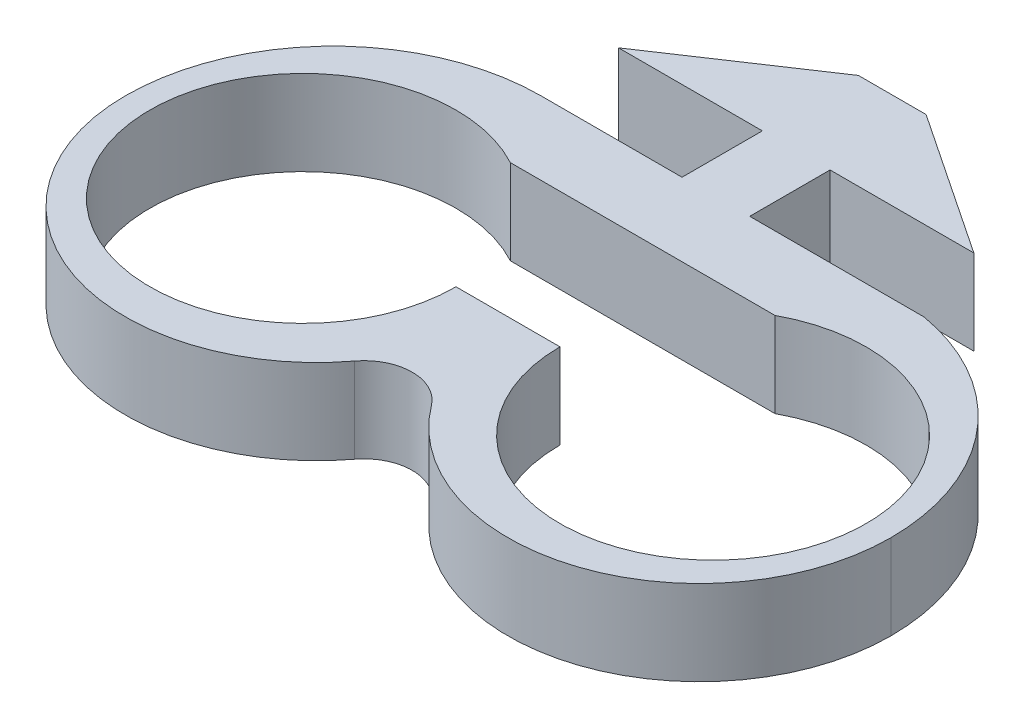
from build123d import *

# Parameters (mm, degrees)
BOSS_EXTRUDE1_DEPTH = 4.5
BOSS_EXTRUDE2_DEPTH = 4.5
SKETCH4_R           = 8.1
CUT_EXTRUDE2_DEPTH  = 32.157524023
CUT_EXTRUDE4_REACH  = 33.158
CUT_EXTRUDE5_REACH  = 33.158


with BuildPart() as part:
    # Sketch1 → Boss-Extrude1 (new body)
    with BuildSketch(Plane(origin=(0, 0, 0), x_dir=(1, 0, 0), z_dir=(0, 1, 0))):
        Polygon((-20.25, -13.1232), (20.25, -13.1232), (20.25, -2.125), (1.7907, -2.125), (1.7907, 2.125), (9.398, 2.125), (1.7907, 7.205), (-1.7907, 7.205), (-9.398, 2.125), (-1.7907, 2.125), (-1.7907, -2.125), (-20.25, -2.125), align=None)
    extrude(amount=BOSS_EXTRUDE1_DEPTH)

    # Sketch3 → Boss-Extrude2 (add)
    with BuildSketch(Plane(origin=(0, 4.5, 0), x_dir=(1, 0, 0), z_dir=(0, 1, 0))):
        Polygon((-20.25, -2.125), (-20.25, -13.1232), (20.25, -13.1232), (20.25, -2.125), (1.7907, -2.125), (1.7907, 2.125), (9.398, 2.125), (1.7907, 7.205), (-1.7907, 7.205), (-9.398, 2.125), (-1.7907, 2.125), (-1.7907, -2.125), align=None)
        with BuildLine():
            Line((20.25, -13.1232), (-20.25, -13.1232))
            ThreePointArc((-20.25, -13.1232), (-13.331227209, -22.72714357), (-2.030596131, -19.205654357))
            ThreePointArc((-2.030596131, -19.205654357), (0, -18.191524388), (2.030596131, -19.205654357))
            ThreePointArc((2.030596131, -19.205654357), (13.331227209, -22.72714357), (20.25, -13.1232))
        make_face()
    extrude(amount=-BOSS_EXTRUDE2_DEPTH)

    # Sketch4 → Cut-Extrude2 (cut, through all)
    with BuildSketch(Plane(origin=(0, 4.5, 0), x_dir=(1, 0, 0), z_dir=(0, 1, 0))):
        with Locations(Location((-10.85, -13.1232, 0), (0, 0, 270))):
            Circle(SKETCH4_R)
        with Locations(Location((10.85, -13.1232, 0), (0, 0, 270))):
            Circle(SKETCH4_R)
    extrude(amount=-CUT_EXTRUDE2_DEPTH, mode=Mode.SUBTRACT)

    # Sketch5 → Cut-Extrude4 (cut, up to next)
    with BuildSketch(Plane(origin=(0, 4.5, 0), x_dir=(1, 0, 0), z_dir=(0, 1, 0)), mode=Mode.PRIVATE) as cut_extrude4_sk1:
        with BuildLine():
            Line((7, -5.996665078), (-7, -5.996665078))
            ThreePointArc((-7, -5.996665078), (-3.893168825, -8.974404994), (-2.75, -13.1232))
            Line((-2.75, -13.1232), (2.75, -13.1232))
            ThreePointArc((2.75, -13.1232), (3.893168825, -8.974404994), (7, -5.996665078))
        make_face()
    cut_extrude4_tool1 = extrude(cut_extrude4_sk1.sketch, amount=-CUT_EXTRUDE4_REACH, mode=Mode.PRIVATE) & part.part
    add(cut_extrude4_tool1.solids().sort_by_distance((0, 4.5, 8.978273))[0], mode=Mode.SUBTRACT)

    # Sketch6 → Cut-Extrude5 (cut, up to next)
    with BuildSketch(Plane(origin=(0, 4.5, 0), x_dir=(1, 0, 0), z_dir=(0, 1, 0)), mode=Mode.PRIVATE) as cut_extrude5_sk1:
        with BuildLine():
            Line((-9.2518, -2.125), (-20.25, -2.125))
            Line((-20.25, -2.125), (-20.25, -13.1232))
            ThreePointArc((-20.25, -13.1232), (-17.028701801, -5.346298199), (-9.2518, -2.125))
        make_face()
    cut_extrude5_tool1 = extrude(cut_extrude5_sk1.sketch, amount=-CUT_EXTRUDE5_REACH, mode=Mode.PRIVATE) & part.part
    # Sketch6 → Cut-Extrude5 (cut, up to next)
    with BuildSketch(Plane(origin=(0, 4.5, 0), x_dir=(1, 0, 0), z_dir=(0, 1, 0)), mode=Mode.PRIVATE) as cut_extrude5_sk2:
        with BuildLine():
            Line((20.25, -13.1232), (20.25, -2.125))
            Line((20.25, -2.125), (11.02035, -2.125))
            ThreePointArc((11.02035, -2.125), (17.636860555, -5.94429266), (20.25, -13.1232))
        make_face()
    cut_extrude5_tool2 = extrude(cut_extrude5_sk2.sketch, amount=-CUT_EXTRUDE5_REACH, mode=Mode.PRIVATE) & part.part
    add(cut_extrude5_tool1.solids().sort_by_distance((-17.793355, 4.5, 4.581645))[0], mode=Mode.SUBTRACT)
    add(cut_extrude5_tool2.solids().sort_by_distance((17.919058, 4.5, 4.610875))[0], mode=Mode.SUBTRACT)


solid = part.part
